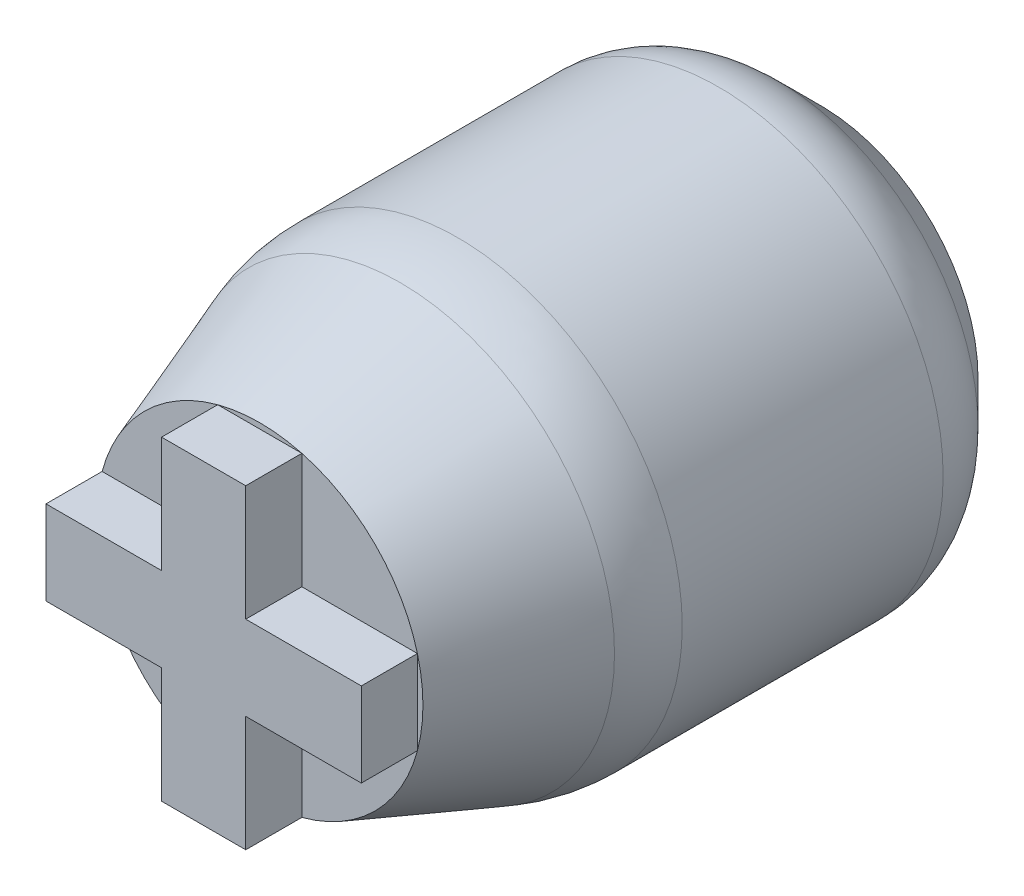
from build123d import *

# Parameters (mm, degrees)
SKETCH1_R           = 4
BOSS_EXTRUDE1_DEPTH = 10
CHAMFER1_SIZE       = 3
CHAMFER1_SIZE2      = 1.091910703
CUT_EXTRUDE1_DEPTH  = 6
CHAMFER2_SIZE       = 1.2
FILLET1_R           = 3
FILLET2_R           = 1.5
BOSS_EXTRUDE2_DEPTH = 1


with BuildPart() as part:
    # Sketch1 → Boss-Extrude1 (new body)
    with BuildSketch(Plane.XY):
        Circle(SKETCH1_R)
    extrude(amount=BOSS_EXTRUDE1_DEPTH)

    # Chamfer1
    chamfer1_edges = [part.edges().sort_by_distance(p)[0] for p in [
        (-4, 0, 10),
    ]]
    chamfer1_side = [part.faces().sort_by_distance(p)[0] for p in [
        (-4, 0, 5),
    ]]
    chamfer(chamfer1_edges, length=CHAMFER1_SIZE, length2=CHAMFER1_SIZE2, reference=chamfer1_side[0])

    # Sketch2 → Cut-Extrude1 (cut)
    with BuildSketch(Plane(origin=(0, 0, 0), x_dir=(-1, 0, 0), z_dir=(0, 0, -1))):
        with BuildLine():
            Line((-1.232882801, -0.55), (1.232882801, -0.55))
            ThreePointArc((1.232882801, -0.55), (0, 1.35), (-1.232882801, -0.55))
        make_face()
    extrude(amount=-CUT_EXTRUDE1_DEPTH, mode=Mode.SUBTRACT)

    # Chamfer2
    chamfer2_edges = [part.edges().sort_by_distance(p)[0] for p in [
        (-4, 0, 0),
    ]]
    chamfer(chamfer2_edges, length=CHAMFER2_SIZE)

    # Fillet1
    fillet1_edges = [part.edges().sort_by_distance(p)[0] for p in [
        (-4, 0, 7),
    ]]
    fillet(fillet1_edges, radius=FILLET1_R)

    # Fillet2
    fillet2_edges = [part.edges().sort_by_distance(p)[0] for p in [
        (-4, 0, 1.2),
    ]]
    fillet(fillet2_edges, radius=FILLET2_R)

    # Sketch3 → Boss-Extrude2 (add)
    with BuildSketch(Plane.XY.offset(10)):
        Polygon((-2.809712327, 0.75), (-0.75, 0.75), (-0.75, 2.809712327), (0.75, 2.809712327), (0.75, 0.75), (2.809712327, 0.75), (2.809712327, -0.75), (0.75, -0.75), (0.75, -2.809712327), (-0.75, -2.809712327), (-0.75, -0.75), (-2.809712327, -0.75), align=None)
    extrude(amount=BOSS_EXTRUDE2_DEPTH)


solid = part.part
